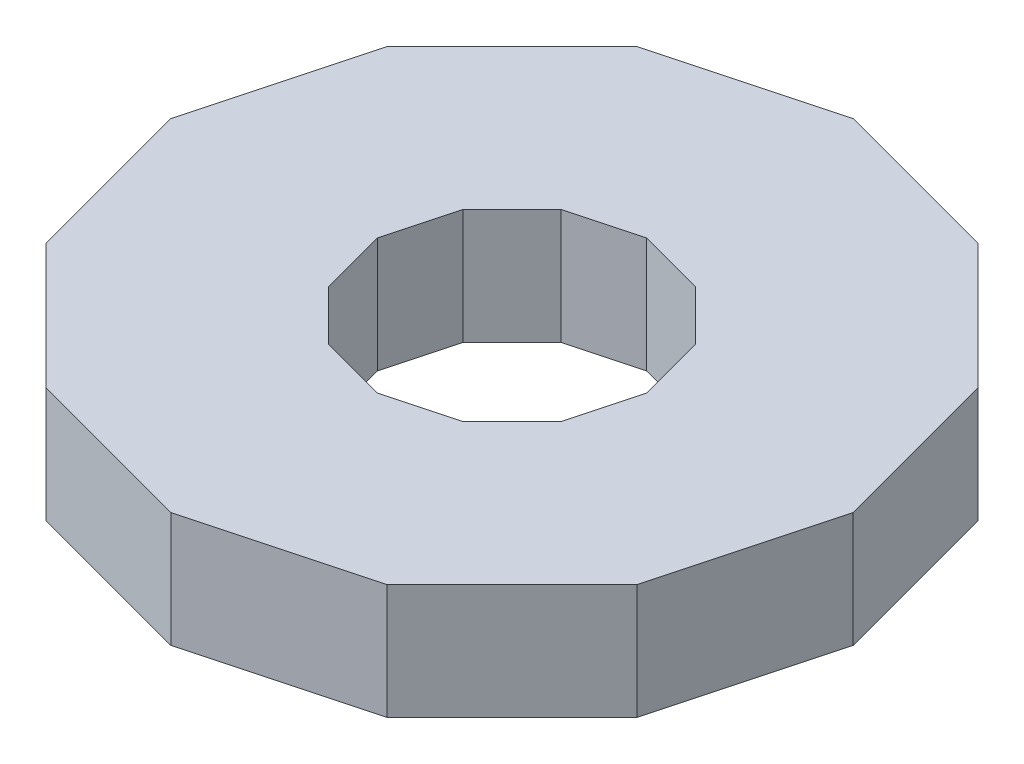
from build123d import *

# Parameters (mm, degrees)
BOSS_EXTRUDE1_DEPTH = 19.05


with BuildPart() as part:
    # Sketch1 → Boss-Extrude1 (new body)
    with BuildSketch(Plane(origin=(0, 0, 0), x_dir=(1, 0, 0), z_dir=(0, 1, 0))):
        Polygon((56.429386772, 0), (48.869282464, 28.214693386), (28.214693386, 48.869282464), (0, 56.429386772), (-28.214693386, 48.869282464), (-48.869282464, 28.214693386), (-56.429386772, 0), (-48.869282464, -28.214693386), (-28.214693386, -48.869282464), (0, -56.429386772), (28.214693386, -48.869282464), (48.869282464, -28.214693386), align=None)
        Polygon((22.244567295, 0), (19.264360373, 11.122283647), (11.122283647, 19.264360373), (0, 22.244567295), (-11.122283647, 19.264360373), (-19.264360373, 11.122283647), (-22.244567295, 0), (-19.264360373, -11.122283647), (-11.122283647, -19.264360373), (0, -22.244567295), (11.122283647, -19.264360373), (19.264360373, -11.122283647), align=None, mode=Mode.SUBTRACT)
    extrude(amount=BOSS_EXTRUDE1_DEPTH)


solid = part.part
